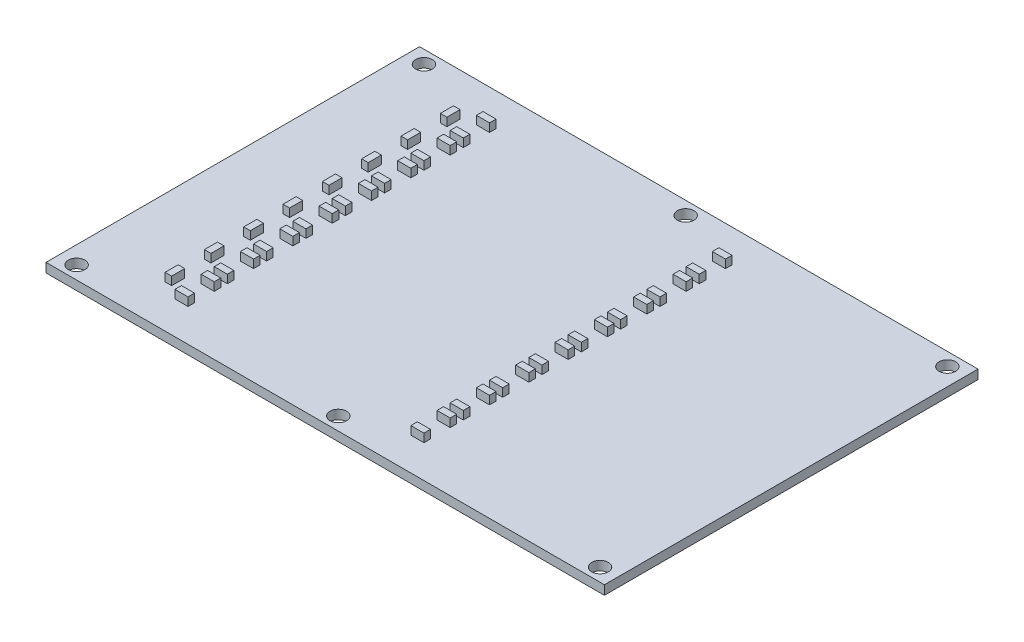
from build123d import *

# Parameters (mm, degrees)
SKETCH1_W                 = 127.8
SKETCH1_H                 = 85.5
BOSS_EXTRUDE1_DEPTH       = 2.1
SKETCH2_R                 = 1.9
CUT_EXTRUDE1_DEPTH        = 154.777436576
LPATTERN1_COUNT           = 3
LPATTERN1_PITCH           = 59.9
MIRROR1_COPY_1_SKETCH_R   = 1.9
MIRROR1_COPY_1_DEPTH      = 154.777436576
MIRROR1_COPY_2_SKETCH_R   = 1.9
MIRROR1_COPY_2_DEPTH      = 154.777436576
SKETCH3_W                 = 3
SKETCH3_H                 = 1.5
BOSS_EXTRUDE2_DEPTH       = 1.9
LPATTERN2_COUNT           = 4
LPATTERN2_PITCH           = 9
MIRROR2_COPY_1_SKETCH_W   = 3
MIRROR2_COPY_1_SKETCH_H   = 1.5
MIRROR2_COPY_1_DEPTH      = 1.9
MIRROR2_COPY_2_SKETCH_W   = 3
MIRROR2_COPY_2_SKETCH_H   = 1.5
MIRROR2_COPY_2_DEPTH      = 1.9
MIRROR2_COPY_3_SKETCH_W   = 3
MIRROR2_COPY_3_SKETCH_H   = 1.5
MIRROR2_COPY_3_DEPTH      = 1.9
LPATTERN3_COUNT           = 2
LPATTERN3_PITCH           = 54
LPATTERN3_COPY_1_SKETCH_W = 3
LPATTERN3_COPY_1_SKETCH_H = 1.5
LPATTERN3_COPY_1_DEPTH    = 1.9
LPATTERN3_COPY_2_SKETCH_W = 3
LPATTERN3_COPY_2_SKETCH_H = 1.5
LPATTERN3_COPY_2_DEPTH    = 1.9
LPATTERN3_COPY_3_SKETCH_W = 3
LPATTERN3_COPY_3_SKETCH_H = 1.5
LPATTERN3_COPY_3_DEPTH    = 1.9
LPATTERN3_COPY_4_SKETCH_W = 3
LPATTERN3_COPY_4_SKETCH_H = 1.5
LPATTERN3_COPY_4_DEPTH    = 1.9
LPATTERN3_COPY_5_SKETCH_W = 3
LPATTERN3_COPY_5_SKETCH_H = 1.5
LPATTERN3_COPY_5_DEPTH    = 1.9
LPATTERN3_COPY_6_SKETCH_W = 3
LPATTERN3_COPY_6_SKETCH_H = 1.5
LPATTERN3_COPY_6_DEPTH    = 1.9
LPATTERN3_COPY_7_SKETCH_W = 3
LPATTERN3_COPY_7_SKETCH_H = 1.5
LPATTERN3_COPY_7_DEPTH    = 1.9
SKETCH4_W                 = 1.5
SKETCH4_H                 = 3
BOSS_EXTRUDE3_DEPTH       = 1.9
LPATTERN4_COUNT           = 8
LPATTERN4_PITCH           = 9


with BuildPart() as part:
    # Sketch1 → Boss-Extrude1 (new body)
    with BuildSketch(Plane(origin=(0, 0, 0), x_dir=(1, 0, 0), z_dir=(0, 1, 0))):
        with Locations((63.9, 42.75)):
            Rectangle(SKETCH1_W, SKETCH1_H)
    extrude(amount=BOSS_EXTRUDE1_DEPTH)

    # Sketch2 → Cut-Extrude1 (cut, through all)
    with BuildSketch(Plane(origin=(0, 2.1, 0), x_dir=(1, 0, 0), z_dir=(0, 1, 0))):
        with Locations(Location((4, 3, 0), (0, 0, 270))):
            Circle(SKETCH2_R)
    cut_extrude1 = extrude(amount=-CUT_EXTRUDE1_DEPTH, mode=Mode.SUBTRACT)

    # LPattern1: Cut-Extrude1 ×3
    with Locations(*[(i * LPATTERN1_PITCH, 0, 0) for i in range(1, LPATTERN1_COUNT)]):
        add(cut_extrude1, mode=Mode.SUBTRACT)

    # Mirror1: Cut-Extrude1 across plane
    add(cut_extrude1.mirror(Plane.XY.offset(-42.75)), mode=Mode.SUBTRACT)

    # Mirror1 copy 1 sketch → Mirror1 copy 1 (cut, through all)
    with BuildSketch(Plane(origin=(59.9, 2.1, -85.5), x_dir=(1, 0, 0), z_dir=(0, 1, 0))):
        with Locations((4, -3)):
            Circle(MIRROR1_COPY_1_SKETCH_R)
    extrude(amount=-MIRROR1_COPY_1_DEPTH, mode=Mode.SUBTRACT)

    # Mirror1 copy 2 sketch → Mirror1 copy 2 (cut, through all)
    with BuildSketch(Plane(origin=(119.8, 2.1, -85.5), x_dir=(1, 0, 0), z_dir=(0, 1, 0))):
        with Locations((4, -3)):
            Circle(MIRROR1_COPY_2_SKETCH_R)
    extrude(amount=-MIRROR1_COPY_2_DEPTH, mode=Mode.SUBTRACT)

    # Sketch3 → Boss-Extrude2 (add)
    with BuildSketch(Plane(origin=(0, 2.1, 0), x_dir=(1, 0, 0), z_dir=(0, 1, 0))):
        with Locations((77.5, 41.25)):
            Rectangle(SKETCH3_W, SKETCH3_H)
        with Locations((77.5, 35.25)):
            Rectangle(SKETCH3_W, SKETCH3_H)
    boss_extrude2 = extrude(amount=BOSS_EXTRUDE2_DEPTH)

    # LPattern2: Boss-Extrude2 ×4
    with Locations(*[(0, 0, i * LPATTERN2_PITCH) for i in range(1, LPATTERN2_COUNT)]):
        add(boss_extrude2)

    # Mirror2: Boss-Extrude2 across plane
    add(boss_extrude2.mirror(Plane.XY.offset(-42.75)))

    # Mirror2 copy 1 sketch → Mirror2 copy 1 (add)
    with BuildSketch(Plane(origin=(0, 2.1, -94.5), x_dir=(1, 0, 0), z_dir=(0, 1, 0))):
        with Locations((77.5, -41.25)):
            Rectangle(MIRROR2_COPY_1_SKETCH_W, MIRROR2_COPY_1_SKETCH_H)
        with Locations((77.5, -35.25)):
            Rectangle(MIRROR2_COPY_1_SKETCH_W, MIRROR2_COPY_1_SKETCH_H)
    extrude(amount=MIRROR2_COPY_1_DEPTH)

    # Mirror2 copy 2 sketch → Mirror2 copy 2 (add)
    with BuildSketch(Plane(origin=(0, 2.1, -103.5), x_dir=(1, 0, 0), z_dir=(0, 1, 0))):
        with Locations((77.5, -41.25)):
            Rectangle(MIRROR2_COPY_2_SKETCH_W, MIRROR2_COPY_2_SKETCH_H)
        with Locations((77.5, -35.25)):
            Rectangle(MIRROR2_COPY_2_SKETCH_W, MIRROR2_COPY_2_SKETCH_H)
    extrude(amount=MIRROR2_COPY_2_DEPTH)

    # Mirror2 copy 3 sketch → Mirror2 copy 3 (add)
    with BuildSketch(Plane(origin=(0, 2.1, -112.5), x_dir=(1, 0, 0), z_dir=(0, 1, 0))):
        with Locations((77.5, -41.25)):
            Rectangle(MIRROR2_COPY_3_SKETCH_W, MIRROR2_COPY_3_SKETCH_H)
        with Locations((77.5, -35.25)):
            Rectangle(MIRROR2_COPY_3_SKETCH_W, MIRROR2_COPY_3_SKETCH_H)
    extrude(amount=MIRROR2_COPY_3_DEPTH)

    # LPattern3: Boss-Extrude2 ×2
    with Locations(*[(-i * LPATTERN3_PITCH, 0, 0) for i in range(1, LPATTERN3_COUNT)]):
        add(boss_extrude2)

    # LPattern3 copy 1 sketch → LPattern3 copy 1 (add)
    with BuildSketch(Plane(origin=(-54, 2.1, 9), x_dir=(1, 0, 0), z_dir=(0, 1, 0))):
        with Locations((77.5, 41.25)):
            Rectangle(LPATTERN3_COPY_1_SKETCH_W, LPATTERN3_COPY_1_SKETCH_H)
        with Locations((77.5, 35.25)):
            Rectangle(LPATTERN3_COPY_1_SKETCH_W, LPATTERN3_COPY_1_SKETCH_H)
    extrude(amount=LPATTERN3_COPY_1_DEPTH)

    # LPattern3 copy 2 sketch → LPattern3 copy 2 (add)
    with BuildSketch(Plane(origin=(-54, 2.1, 18), x_dir=(1, 0, 0), z_dir=(0, 1, 0))):
        with Locations((77.5, 41.25)):
            Rectangle(LPATTERN3_COPY_2_SKETCH_W, LPATTERN3_COPY_2_SKETCH_H)
        with Locations((77.5, 35.25)):
            Rectangle(LPATTERN3_COPY_2_SKETCH_W, LPATTERN3_COPY_2_SKETCH_H)
    extrude(amount=LPATTERN3_COPY_2_DEPTH)

    # LPattern3 copy 3 sketch → LPattern3 copy 3 (add)
    with BuildSketch(Plane(origin=(-54, 2.1, 27), x_dir=(1, 0, 0), z_dir=(0, 1, 0))):
        with Locations((77.5, 41.25)):
            Rectangle(LPATTERN3_COPY_3_SKETCH_W, LPATTERN3_COPY_3_SKETCH_H)
        with Locations((77.5, 35.25)):
            Rectangle(LPATTERN3_COPY_3_SKETCH_W, LPATTERN3_COPY_3_SKETCH_H)
    extrude(amount=LPATTERN3_COPY_3_DEPTH)

    # LPattern3 copy 4 sketch → LPattern3 copy 4 (add)
    with BuildSketch(Plane(origin=(-54, 2.1, -85.5), x_dir=(1, 0, 0), z_dir=(0, 1, 0))):
        with Locations((77.5, -41.25)):
            Rectangle(LPATTERN3_COPY_4_SKETCH_W, LPATTERN3_COPY_4_SKETCH_H)
        with Locations((77.5, -35.25)):
            Rectangle(LPATTERN3_COPY_4_SKETCH_W, LPATTERN3_COPY_4_SKETCH_H)
    extrude(amount=LPATTERN3_COPY_4_DEPTH)

    # LPattern3 copy 5 sketch → LPattern3 copy 5 (add)
    with BuildSketch(Plane(origin=(-54, 2.1, -94.5), x_dir=(1, 0, 0), z_dir=(0, 1, 0))):
        with Locations((77.5, -41.25)):
            Rectangle(LPATTERN3_COPY_5_SKETCH_W, LPATTERN3_COPY_5_SKETCH_H)
        with Locations((77.5, -35.25)):
            Rectangle(LPATTERN3_COPY_5_SKETCH_W, LPATTERN3_COPY_5_SKETCH_H)
    extrude(amount=LPATTERN3_COPY_5_DEPTH)

    # LPattern3 copy 6 sketch → LPattern3 copy 6 (add)
    with BuildSketch(Plane(origin=(-54, 2.1, -103.5), x_dir=(1, 0, 0), z_dir=(0, 1, 0))):
        with Locations((77.5, -41.25)):
            Rectangle(LPATTERN3_COPY_6_SKETCH_W, LPATTERN3_COPY_6_SKETCH_H)
        with Locations((77.5, -35.25)):
            Rectangle(LPATTERN3_COPY_6_SKETCH_W, LPATTERN3_COPY_6_SKETCH_H)
    extrude(amount=LPATTERN3_COPY_6_DEPTH)

    # LPattern3 copy 7 sketch → LPattern3 copy 7 (add)
    with BuildSketch(Plane(origin=(-54, 2.1, -112.5), x_dir=(1, 0, 0), z_dir=(0, 1, 0))):
        with Locations((77.5, -41.25)):
            Rectangle(LPATTERN3_COPY_7_SKETCH_W, LPATTERN3_COPY_7_SKETCH_H)
        with Locations((77.5, -35.25)):
            Rectangle(LPATTERN3_COPY_7_SKETCH_W, LPATTERN3_COPY_7_SKETCH_H)
    extrude(amount=LPATTERN3_COPY_7_DEPTH)

    # Sketch4 → Boss-Extrude3 (add)
    with BuildSketch(Plane(origin=(0, 2.1, 0), x_dir=(1, 0, 0), z_dir=(0, 1, 0))):
        with Locations((18.25, 74.25)):
            Rectangle(SKETCH4_W, SKETCH4_H)
    boss_extrude3 = extrude(amount=BOSS_EXTRUDE3_DEPTH)

    # LPattern4: Boss-Extrude3 ×8
    with Locations(*[(0, 0, i * LPATTERN4_PITCH) for i in range(1, LPATTERN4_COUNT)]):
        add(boss_extrude3)


solid = part.part
